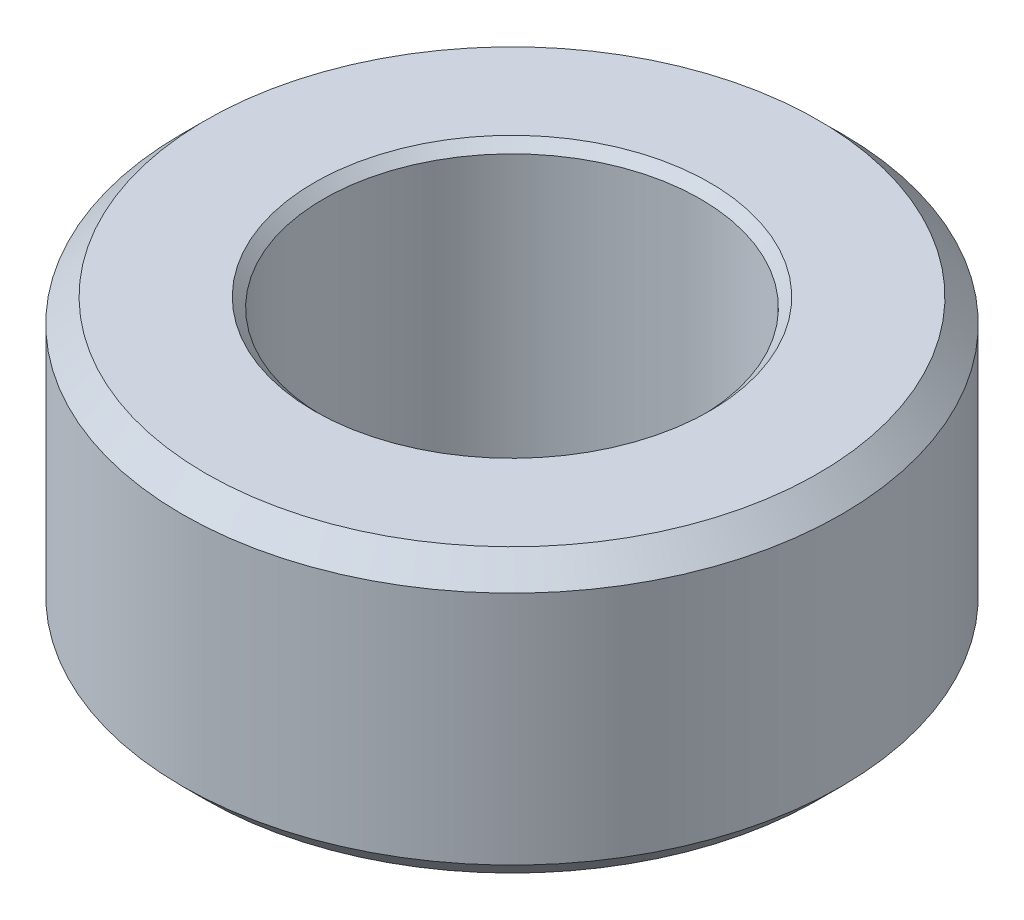
from build123d import *

# Parameters (mm, degrees)
SKETCH1_R           = 7
SKETCH1_R_2         = 4
BOSS_EXTRUDE1_DEPTH = 6
CHAMFER1_SIZE       = 0.5
CHAMFER2_SIZE       = 0.2


with BuildPart() as part:
    # Sketch1 → Boss-Extrude1 (new body)
    with BuildSketch(Plane(origin=(0, 0, 0), x_dir=(1, 0, 0), z_dir=(0, 1, 0))):
        with Locations(Location((0, 0, 0), (0, 0, 270))):
            Circle(SKETCH1_R)
        with Locations(Location((0, 0, 0), (0, 0, 270))):
            Circle(SKETCH1_R_2, mode=Mode.SUBTRACT)
    extrude(amount=BOSS_EXTRUDE1_DEPTH)

    # Chamfer1
    chamfer1_edges = [part.edges().sort_by_distance(p)[0] for p in [
        (0, 0, -7),
        (0, 6, -7),
    ]]
    chamfer(chamfer1_edges, length=CHAMFER1_SIZE)

    # Chamfer2
    chamfer2_edges = [part.edges().sort_by_distance(p)[0] for p in [
        (0, 0, -4),
        (0, 6, -4),
    ]]
    chamfer(chamfer2_edges, length=CHAMFER2_SIZE)


solid = part.part
